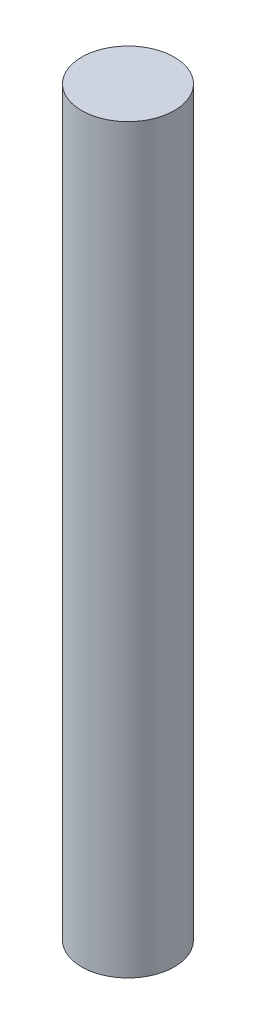
from build123d import *

# Parameters (mm, degrees)
SZKIC1_R                    = 0.125
DODANIE_WYCI_GNI_CIE1_DEPTH = 2


with BuildPart() as part:
    # Szkic1 → Dodanie-wyciągnięcie1 (new body)
    with BuildSketch(Plane(origin=(0, 0, 0), x_dir=(1, 0, 0), z_dir=(0, 1, 0))):
        with Locations(Location((0, 0, 0), (0, 0, 270))):
            Circle(SZKIC1_R)
    extrude(amount=DODANIE_WYCI_GNI_CIE1_DEPTH)


solid = part.part
